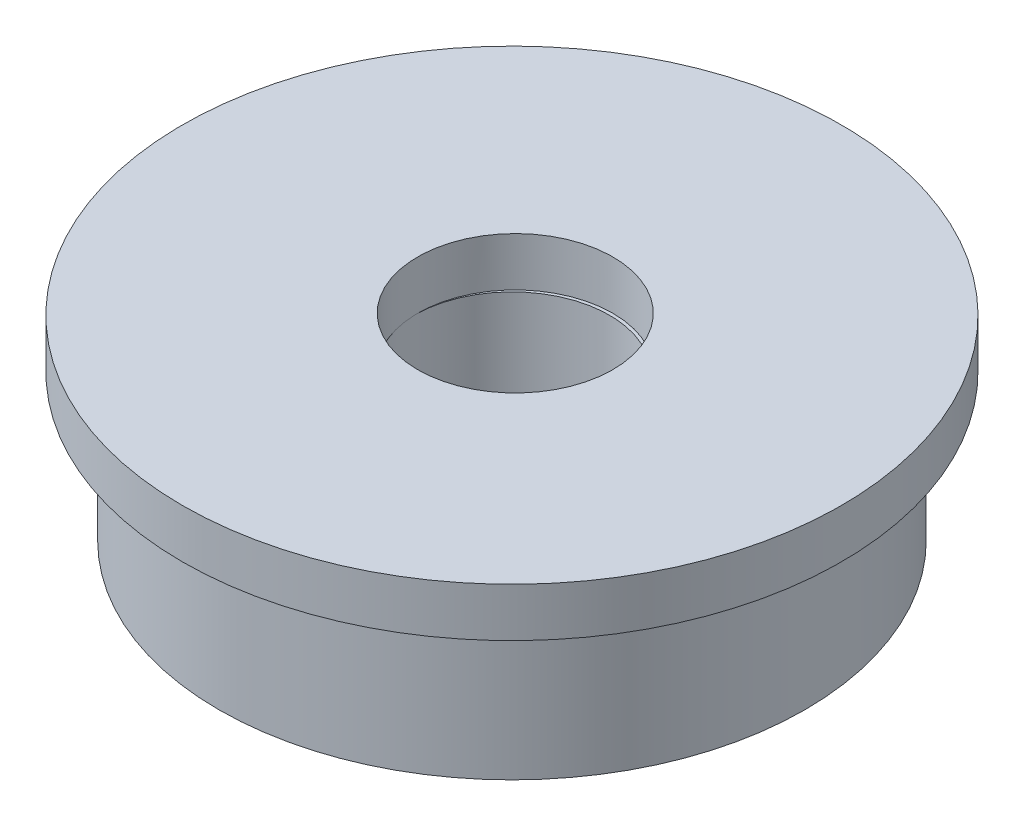
from build123d import *

# Parameters (mm, degrees)
SKETCH_1_R      = 6
SKETCH_1_R_2    = 2
EXTRUDE_1_DEPTH = 3
SKETCH_2_R      = 6.75
SKETCH_2_R_2    = 2
EXTRUDE_2_DEPTH = 1


with BuildPart() as part:
    # 草图1 → 凸台-拉伸1 (new body)
    with BuildSketch(Plane(origin=(0, 0, 0), x_dir=(1, 0, 0), z_dir=(0, 1, 0))):
        with Locations(Location((0, 0, 0), (0, 0, 270))):
            Circle(SKETCH_1_R)
        with Locations(Location((0, 0, 0), (0, 0, 270))):
            Circle(SKETCH_1_R_2, mode=Mode.SUBTRACT)
    extrude(amount=EXTRUDE_1_DEPTH)

    # 草图2 → 凸台-拉伸2 (add)
    with BuildSketch(Plane(origin=(0, 3, 0), x_dir=(1, 0, 0), z_dir=(0, 1, 0))):
        with Locations(Location((0, 0, 0), (0, 0, 270))):
            Circle(SKETCH_2_R)
        with Locations(Location((0, 0.067811987, 0), (0, 0, 359.028618299))):
            Circle(SKETCH_2_R_2, mode=Mode.SUBTRACT)
    extrude(amount=EXTRUDE_2_DEPTH)


solid = part.part
